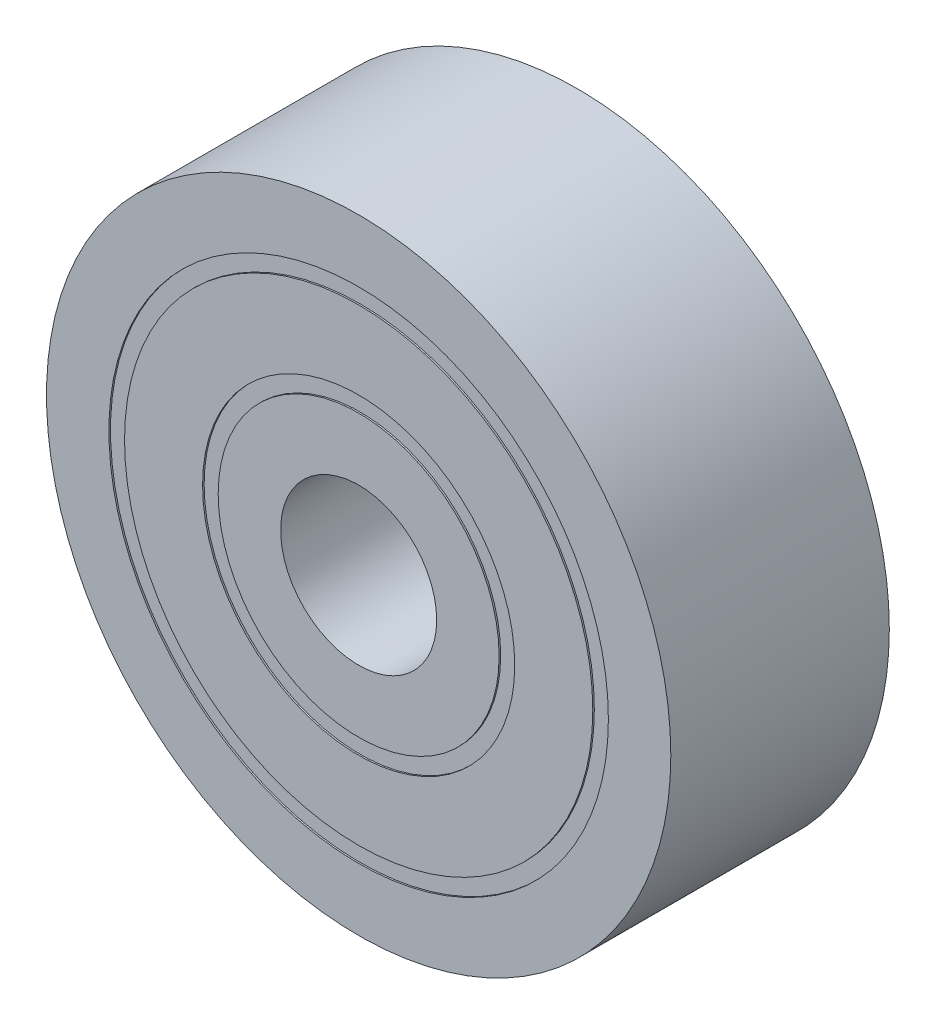
from build123d import *

# Parameters (mm, degrees)
ESBO_O1_R                = 50
ESBO_O1_R_2              = 12.5
RESSALTO_EXTRUS_O1_DEPTH = 17.5
ESBO_O2_R                = 40
ESBO_O2_R_2              = 37.5
ESBO_O2_R_3              = 25
ESBO_O2_R_4              = 22.5
CORTE_EXTRUS_O1_DEPTH    = 0.25


with BuildPart() as part:
    # Esboço1 → Ressalto-extrusão1 (new, symmetric)
    with BuildSketch(Plane.XY):
        Circle(ESBO_O1_R)
        Circle(ESBO_O1_R_2, mode=Mode.SUBTRACT)
    extrude(amount=RESSALTO_EXTRUS_O1_DEPTH, both=True)

    # Esboço2 → Corte-extrusão1 (cut)
    # profile 1 of 2: a face of its own
    with BuildSketch(Plane.XY.offset(17.5)):
        Circle(ESBO_O2_R)
        Circle(ESBO_O2_R_2, mode=Mode.SUBTRACT)
    # profile 2 of 2: a face of its own
    with BuildSketch(Plane.XY.offset(17.5)):
        Circle(ESBO_O2_R_3)
        Circle(ESBO_O2_R_4, mode=Mode.SUBTRACT)
    corte_extrus_o1 = extrude(amount=-CORTE_EXTRUS_O1_DEPTH, mode=Mode.SUBTRACT)

    # Espelhar1: Corte-extrusão1 across plane
    add(corte_extrus_o1.mirror(Plane.XY), mode=Mode.SUBTRACT)


solid = part.part
